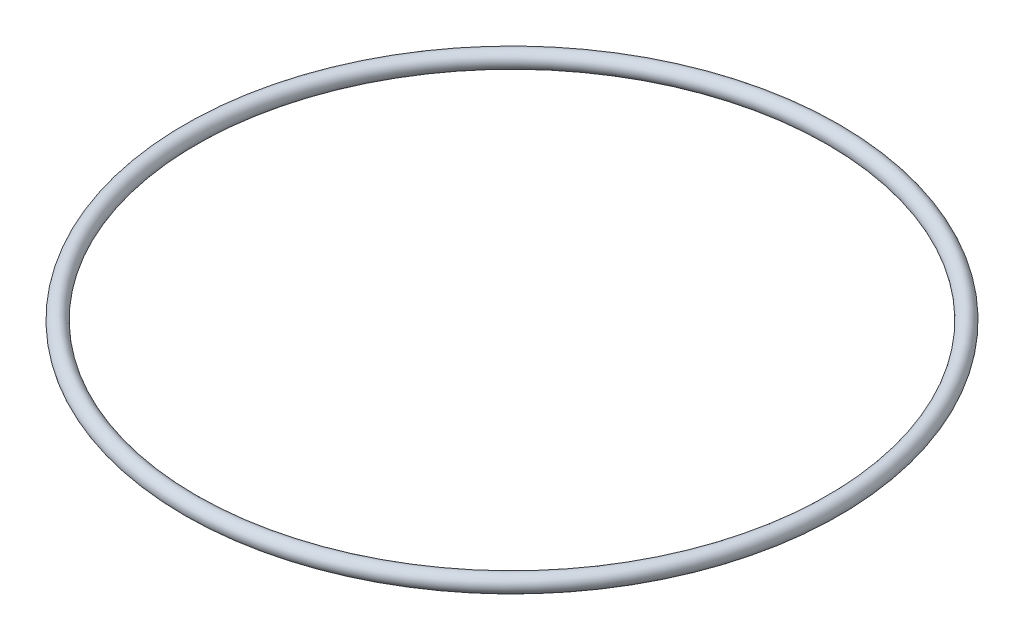
from build123d import *

# Parameters (mm, degrees)
SKETCH1_R = 1.25


with BuildPart() as part:
    # Sketch1 → Revolve1 (revolve)
    with BuildSketch(Plane.XY, mode=Mode.PRIVATE) as revolve1_sk:
        with Locations((-48.87, 0)):
            Circle(SKETCH1_R)
    revolve(revolve1_sk.sketch.rotate(Axis((0, 0, 0), (0, 1, 0)), 270), axis=Axis((0, 0, 0), (0, 1, 0)))


solid = part.part
